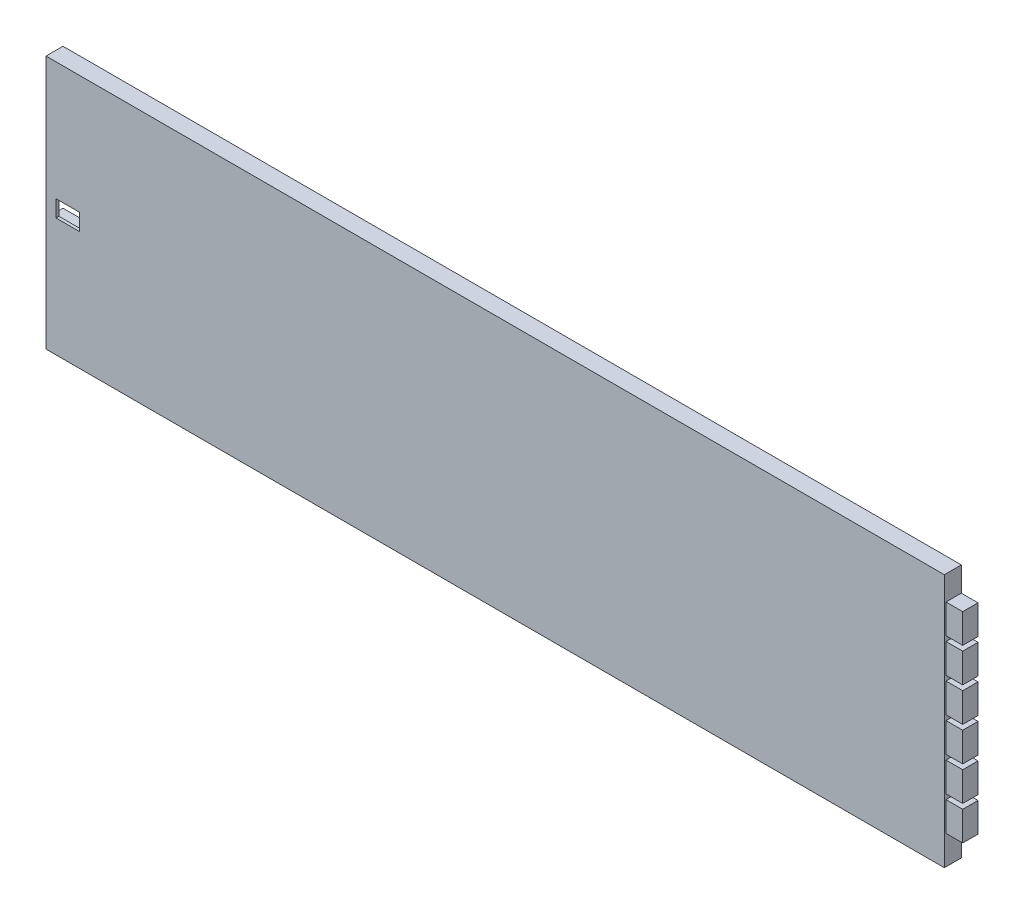
from build123d import *

# Parameters (mm, degrees)
SKETCH1_W           = 5.08
SKETCH1_H           = 76
BOSS_EXTRUDE1_DEPTH = 269
SKETCH2_W           = 4.58
SKETCH2_H           = 8.75
BOSS_EXTRUDE2_DEPTH = 5
SKETCH5_W           = 4.2
SKETCH5_H           = 8
CUT_EXTRUDE1_DEPTH  = 15
SKETCH6_W           = 7
SKETCH6_H           = 5
CUT_EXTRUDE2_DEPTH  = 15
SKETCH8_R           = 1.4
BOSS_EXTRUDE3_DEPTH = 2


with BuildPart() as part:
    # Sketch1 → Boss-Extrude1 (new body)
    with BuildSketch(Plane(origin=(0, 0, 0), x_dir=(0, 0, -1), z_dir=(1, 0, 0))):
        Rectangle(SKETCH1_W, SKETCH1_H)
    extrude(amount=BOSS_EXTRUDE1_DEPTH)

    # Sketch2 → Boss-Extrude2 (add)
    with BuildSketch(Plane(origin=(269, 0, 0), x_dir=(0, 0, -1), z_dir=(1, 0, 0))):
        with Locations((0.25, 26.295)):
            Rectangle(SKETCH2_W, SKETCH2_H)
        with Locations((0.25, 5.795)):
            Rectangle(SKETCH2_W, SKETCH2_H)
        with Locations((0.25, 16.045)):
            Rectangle(SKETCH2_W, SKETCH2_H)
        with Locations((0.25, -4.455)):
            Rectangle(SKETCH2_W, SKETCH2_H)
        with Locations((0.25, -14.705)):
            Rectangle(SKETCH2_W, SKETCH2_H)
        with Locations((0.25, -24.955)):
            Rectangle(SKETCH2_W, SKETCH2_H)
    extrude(amount=BOSS_EXTRUDE2_DEPTH)

    # Sketch5 → Cut-Extrude1 (cut)
    with BuildSketch(Plane.ZY):
        with Locations((-0.44, 0)):
            Rectangle(SKETCH5_W, SKETCH5_H)
    extrude(amount=-CUT_EXTRUDE1_DEPTH, mode=Mode.SUBTRACT)

    # Sketch6 → Cut-Extrude2 (cut)
    with BuildSketch(Plane(origin=(0, 0, 1.66), x_dir=(-1, 0, 0), z_dir=(0, 0, -1))):
        with Locations((-6.5, 0)):
            Rectangle(SKETCH6_W, SKETCH6_H)
    extrude(amount=-CUT_EXTRUDE2_DEPTH, mode=Mode.SUBTRACT)

    # Sketch8 → Boss-Extrude3 (add)
    with BuildSketch(Plane.ZY.offset(-15)):
        with Locations(Location((0, 0, 0), (0, 0, 180))):
            Circle(SKETCH8_R)
    extrude(amount=BOSS_EXTRUDE3_DEPTH)


solid = part.part
